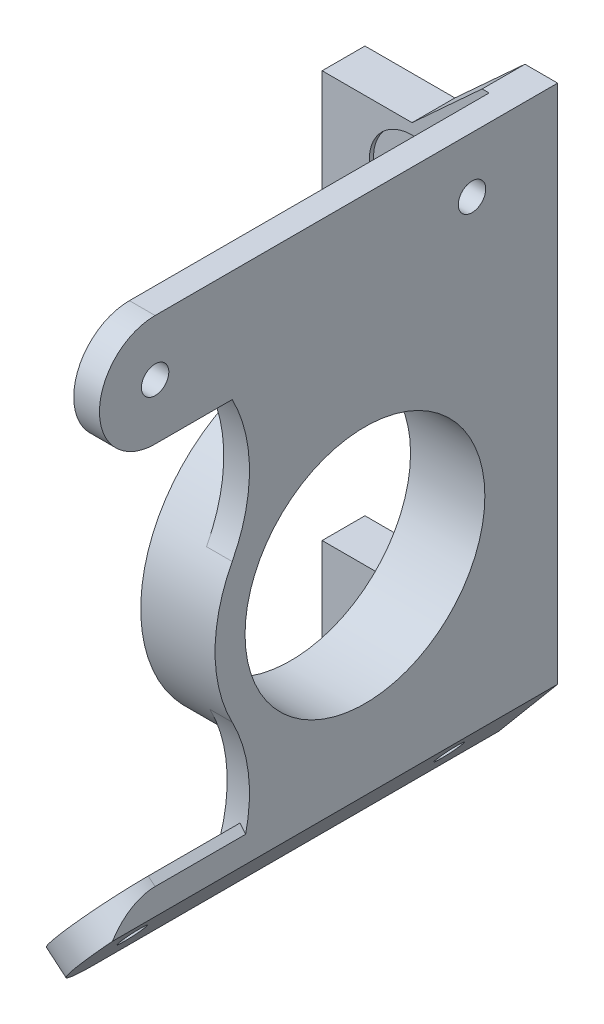
from build123d import *

# Parameters (mm, degrees)
EXTRUDE_2_DEPTH                = 5
SKETCH_4_W                     = 8.676470589
SKETCH_4_H                     = 35
SKETCH_4_W_2                   = 8.676470588
EXTRUDE_15_DEPTH               = 35
CUT_EXTRUDE_1_DEPTH            = 45
SKETCH_6_R                     = 14
CUT_EXTRUDE_2_DEPTH            = 45
FILLET_1_R                     = 5
SKETCH_7_R                     = 15
SKETCH_7_R_2                   = 13
EXTRUDE_16_DEPTH               = 1
SPLIT_BODIES_1_SURFACE_1_BACK  = 86
SPLIT_BODIES_1_SURFACE_1_DEPTH = 172
SPLIT_BODIES_1_SURFACE_2_BACK  = 86
SPLIT_BODIES_1_SURFACE_2_DEPTH = 172
HOLE_WIZARD_1_D                = 4.3
HOLE_WIZARD_1_DEPTH            = 5
HOLE_WIZARD_1_CBORE_D          = 10
HOLE_WIZARD_1_CBORE_DEPTH      = 0.5
HOLE_WIZARD_1_TIP              = 1.291850331
SKETCH_17_W                    = 3
SKETCH_17_H                    = 13
EXTRUDE_20_DEPTH               = 42
EXTRUDE_21_DEPTH               = 3
SKETCH_19_R                    = 1.6
CUT_EXTRUDE_3_DEPTH            = 3
EXTRUDE_START                  = -3
EXTRUDE_25_DEPTH               = 3
EXTRUDE_22_DEPTH               = 5
EXTRUDE_26_DEPTH               = 42
EXTRUDE_START_2                = -2.6
EXTRUDE_27_DEPTH               = 2.6
CUT_EXTRUDE_5_DEPTH            = 22.6
EXTRUDE_29_REACH               = 85.035
SKETCH_42_R                    = 1.5
CUT_EXTRUDE_6_DEPTH            = 84.034846606
CUT_EXTRUDE_7_DEPTH            = 8.6
EXTRUDE_31_DEPTH               = 5


with BuildPart() as part:
    # 草图2 → 凸台-拉伸2 (new body)
    with BuildSketch(Plane.XY):
        Polygon((7.726423565, 24.338235294), (-14.773576435, 24.338235294), (-14.773576435, -35.661764706), (7.726423565, -35.661764706), (7.726423565, -23.161764706), (-6.097105846, -23.161764706), (-6.097105846, 11.838235294), (7.726423565, 11.838235294), align=None)
        Polygon((30.226423565, 24.338235294), (7.726423565, 24.338235294), (7.726423565, 11.838235294), (21.549952977, 11.838235294), (21.549952977, -23.161764706), (7.726423565, -23.161764706), (7.726423565, -35.661764706), (30.226423565, -35.661764706), align=None)
    extrude(amount=EXTRUDE_2_DEPTH)

    # 草图4 → 凸台-拉伸15 (add)
    with BuildSketch(Plane.XY.offset(5)):
        with Locations((-10.435341141, -5.661764706)):
            Rectangle(SKETCH_4_W, SKETCH_4_H)
        with Locations((25.888188271, -5.661764706)):
            Rectangle(SKETCH_4_W_2, SKETCH_4_H)
    extrude(amount=EXTRUDE_15_DEPTH)

    # 草图5 → 切除-拉伸1 (cut)
    with BuildSketch(Plane.ZY.offset(14.773576435)):
        with BuildLine():
            Line((40, -23.161764706), (40, -5.661764706))
            ThreePointArc((40, -5.661764706), (34.874368671, -18.036133377), (22.5, -23.161764706))
            Line((22.5, -23.161764706), (40, -23.161764706))
        make_face()
        with BuildLine():
            ThreePointArc((22.5, 11.838235294), (34.874368671, 6.712603965), (40, -5.661764706))
            Line((40, -5.661764706), (40, 11.838235294))
            Line((40, 11.838235294), (22.5, 11.838235294))
        make_face()
    extrude(amount=-CUT_EXTRUDE_1_DEPTH, mode=Mode.SUBTRACT)

    # 草图6 → 切除-拉伸2 (cut)
    with BuildSketch(Plane.ZY.offset(14.773576435)):
        with Locations((22.5, -5.661764706)):
            Circle(SKETCH_6_R)
    extrude(amount=-CUT_EXTRUDE_2_DEPTH, mode=Mode.SUBTRACT)

    # 圆角1
    fillet_1_edges = [part.edges().sort_by_distance(p)[0] for p in [
        (-6.097105846, 11.838235294, 2.5),
        (-6.097105846, -23.161764706, 2.5),
        (21.549952977, -23.161764706, 2.5),
        (21.549952977, 11.838235294, 2.5),
    ]]
    fillet(fillet_1_edges, radius=FILLET_1_R)

    # 草图7 → 凸台-拉伸16 (add)
    with BuildSketch(Plane(origin=(-6.097105846, 0, 0), x_dir=(0, 0, -1), z_dir=(1, 0, 0))):
        with Locations((-22.5, -5.661764706)):
            Circle(SKETCH_7_R)
        with Locations((-22.5, -5.661764706)):
            Circle(SKETCH_7_R_2, mode=Mode.SUBTRACT)
    extrude(amount=-EXTRUDE_16_DEPTH)


with BuildPart() as body_2:
    # Split Bodies 1: the piece behind the surface
    add(part.part)
    # Split Bodies 1 surface: a surface, the sketch's curves swept straight by 172 mm
    with BuildLine(Plane.XY.offset(5).offset(-SPLIT_BODIES_1_SURFACE_1_BACK), mode=Mode.PRIVATE) as split_bodies_1_surface_1_path:
        Line((7.726423565, 24.338235294), (7.726423565, -35.661764706))
    split_bodies_1_surface_1 = Shell.extrude(split_bodies_1_surface_1_path.wire(), (0 * SPLIT_BODIES_1_SURFACE_1_DEPTH, 0 * SPLIT_BODIES_1_SURFACE_1_DEPTH, 1 * SPLIT_BODIES_1_SURFACE_1_DEPTH))
    split(bisect_by=split_bodies_1_surface_1, keep=Keep.BOTTOM)


with BuildPart() as part_1:
    add(part.part)

    # Split Bodies 1: split by a surface, the side it looks to stays
    # Split Bodies 1 surface: a surface, the sketch's curves swept straight by 172 mm
    with BuildLine(Plane.XY.offset(5).offset(-SPLIT_BODIES_1_SURFACE_2_BACK), mode=Mode.PRIVATE) as split_bodies_1_surface_2_path:
        Line((7.726423565, 24.338235294), (7.726423565, -35.661764706))
    split_bodies_1_surface_2 = Shell.extrude(split_bodies_1_surface_2_path.wire(), (0 * SPLIT_BODIES_1_SURFACE_2_DEPTH, 0 * SPLIT_BODIES_1_SURFACE_2_DEPTH, 1 * SPLIT_BODIES_1_SURFACE_2_DEPTH))
    split(bisect_by=split_bodies_1_surface_2, keep=Keep.TOP)

    # 打孔尺寸(%根据六角头螺)栓 全螺纹的类型1
    with Locations(Plane(origin=(18.226423565, 18.088235294, 5), x_dir=(1, 0, 0), z_dir=(0, 0, 1))):
        with Locations((0, 0), (0, -47.5)):
            CounterBoreHole(HOLE_WIZARD_1_D / 2, HOLE_WIZARD_1_CBORE_D / 2, HOLE_WIZARD_1_CBORE_DEPTH, depth=HOLE_WIZARD_1_DEPTH)
            with Locations((0, 0, -(HOLE_WIZARD_1_DEPTH + HOLE_WIZARD_1_TIP / 2))):  # 118° drill point
                Cone(0, HOLE_WIZARD_1_D / 2, HOLE_WIZARD_1_TIP, mode=Mode.SUBTRACT)

    # 草图17 → 凸台-拉伸20 (add)
    with BuildSketch(Plane.XY.offset(5)):
        with Locations((28.726423565, 25.338235294)):
            Rectangle(SKETCH_17_W, SKETCH_17_H)
    extrude(amount=EXTRUDE_20_DEPTH)

    # 草图18 → 凸台-拉伸21 (add)
    with BuildSketch(Plane(origin=(30.226423565, 0, 0), x_dir=(0, 0, -1), z_dir=(1, 0, 0))):
        with BuildLine():
            Line((-47, 18.838235294), (-47, 31.838235294))
            ThreePointArc((-47, 31.838235294), (-53.5, 25.338235294), (-47, 18.838235294))
        make_face()
    extrude(amount=-EXTRUDE_21_DEPTH)

    # 草图19 → 切除-拉伸3 (cut)
    with BuildSketch(Plane(origin=(30.226423565, 0, 0), x_dir=(0, 0, -1), z_dir=(1, 0, 0))):
        with Locations((-47, 25.338235294)):
            Circle(SKETCH_19_R)
        with Locations((-10, 25.338235294)):
            Circle(SKETCH_19_R)
    extrude(amount=-CUT_EXTRUDE_3_DEPTH, mode=Mode.SUBTRACT)

    # 草图24 → 凸台-拉伸25 (add)
    with BuildSketch(Plane(origin=(30.226423565, 0, 0), x_dir=(0, 0, -1), z_dir=(1, 0, 0)).offset(EXTRUDE_START)):
        with BuildLine():
            Line((-5, 18.838235294), (-38, 18.838235294))
            ThreePointArc((-38, 18.838235294), (-35.984258471, 10.650254496), (-38, 2.462273699))
            ThreePointArc((-38, 2.462273699), (-31.557574949, 9.311890026), (-22.5, 11.838235294))
            Line((-22.5, 11.838235294), (-5, 11.838235294))
            Line((-5, 11.838235294), (-5, 18.838235294))
        make_face()
    extrude(amount=EXTRUDE_25_DEPTH)

    # 草图21 → 凸台-拉伸22 (add)
    with BuildSketch(Plane.XY.offset(5)):
        Polygon((18.226423565, 24.338235294), (30.226423565, 24.338235294), (30.226423565, 31.838235294), (26.408241747, 31.838235294), align=None)
    extrude(amount=-EXTRUDE_22_DEPTH)

    # 草图34 → 凸台-拉伸26 (add)
    with BuildSketch(Plane.XY.offset(5)):
        Polygon((21.07205131, -35.191979637), (23.370184639, -37.120342466), (30.226423565, -28.949395095), (30.226423565, -25.903115259), (29.428290236, -25.233401877), align=None)
    extrude(amount=EXTRUDE_26_DEPTH)

    # 草图37 → 凸台-拉伸27 (add)
    with BuildSketch(Plane(origin=(30.226423565, 0, 0), x_dir=(0, 0, -1), z_dir=(1, 0, 0)).offset(EXTRUDE_START_2)):
        with BuildLine():
            Line((-37.42228501, -28.949395095), (-5, -28.949395095))
            Line((-5, -28.949395095), (-5, -23.161764706))
            Line((-5, -23.161764706), (-22.5, -23.161764706))
            ThreePointArc((-22.5, -23.161764706), (-31.557574949, -20.635419438), (-38, -13.785803111))
            ThreePointArc((-38, -13.785803111), (-35.997045319, -21.302294019), (-37.42228501, -28.949395095))
        make_face()
    extrude(amount=EXTRUDE_27_DEPTH)

    # 草图38 → 切除-拉伸5 (cut)
    with BuildSketch(Plane.XY.offset(5)):
        Polygon((30.226423565, -35.661764706), (30.226423565, -28.949395095), (24.5940767, -35.661764706), align=None)
    extrude(amount=-CUT_EXTRUDE_5_DEPTH, mode=Mode.SUBTRACT)

    # 凸台-拉伸29: up to this face of the body (flat: up to its plane)
    extrude_29_end = Plane(part_1.part.faces().sort_by_distance((24.617542998, -30.966627181, 27.010629393))[0])
    # 草图41 → 凸台-拉伸29 (add, up to the picked face)
    with BuildSketch(Plane(origin=(31.992387835, -26.844800832, 0), x_dir=(0, 0, -1), z_dir=(0.7660444431189818, -0.6427876096865348, 0)), mode=Mode.PRIVATE) as extrude_29_sk1:
        with BuildLine():
            Line((-47, -13.413766951), (-47, -0.413766951))
            ThreePointArc((-47, -0.413766951), (-53.5, -6.913766951), (-47, -13.413766951))
        make_face()
    extrude_29_tool1 = split(extrude(extrude_29_sk1.sketch, amount=-EXTRUDE_29_REACH, mode=Mode.PRIVATE), bisect_by=extrude_29_end, keep=Keep.BOTH, mode=Mode.PRIVATE)
    add(extrude_29_tool1.solids().sort_by(Axis((27.548304, -32.141054, 49.758686), (-0.7660444431189818, 0.6427876096865348, 0)))[0])

    # 草图42 → 切除-拉伸6 (cut, through all)
    with BuildSketch(Plane(origin=(31.992387835, -26.844800832, 0), x_dir=(0, 0, -1), z_dir=(0.7660444431189818, -0.6427876096865348, 0))):
        with Locations(Location((-47, -6.913766951, 0), (0, 0, 90))):
            Circle(SKETCH_42_R)
        with Locations(Location((-10, -6.913766951, 0), (0, 0, 90))):
            Circle(SKETCH_42_R)
    extrude(amount=-CUT_EXTRUDE_6_DEPTH, mode=Mode.SUBTRACT)

    # 草图44 → 切除-拉伸7 (cut)
    with BuildSketch(Plane(origin=(0, 0, 47), x_dir=(-1, 0, 0), z_dir=(0, 0, -1))):
        Polygon((-31.726423565, -27.161764706), (-30.226423565, -28.949395095), (-30.226423565, -25.903115259), align=None)
    extrude(amount=-CUT_EXTRUDE_7_DEPTH, mode=Mode.SUBTRACT)

    # 草图39 → 凸台-拉伸31 (add)
    with BuildSketch(Plane.XY.offset(5)):
        Polygon((24.5940767, -35.661764706), (21.631919353, -35.661764706), (23.370184639, -37.120342466), align=None)
    extrude(amount=-EXTRUDE_31_DEPTH)


solid = part_1.part
